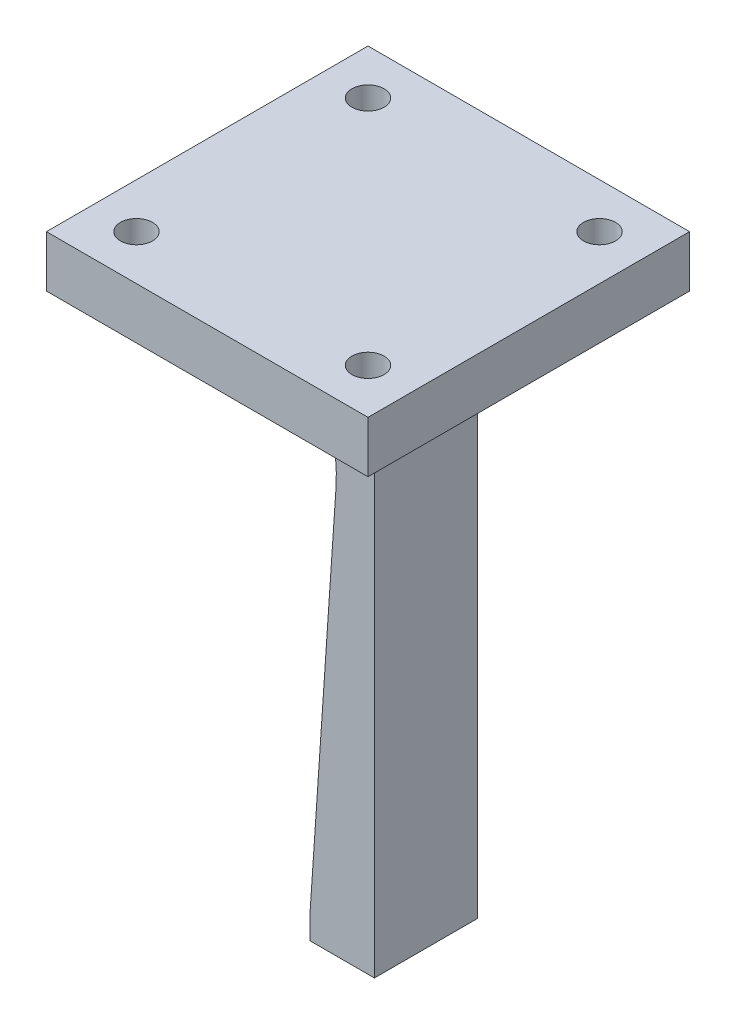
from build123d import *

# Parameters (mm, degrees)
SKETCH_1_W           = 25
SKETCH_1_H           = 25
SKETCH_1_W_2         = 13
SKETCH_1_H_2         = 13
EXTRUDE_1_DEPTH      = 4
EXTRUDE_5_DEPTH      = 4
EXTRUDE_5_DEPTH_BACK = 4
EXTRUDE_6_DEPTH      = 8
EXTRUDE_7_DEPTH      = 8
SKETCH_10_W          = 13
SKETCH_10_H          = 13.001688454
EXTRUDE_8_DEPTH      = 2
SKETCH_11_R          = 1.25
CUT_EXTRUDE_1_DEPTH  = 54.272882407


with BuildPart() as part:
    # Эскиз1 → Бобышка-Вытянуть1 (new body)
    with BuildSketch(Plane(origin=(0, 0, 0), x_dir=(1, 0, 0), z_dir=(0, 1, 0))):
        with Locations((6.5, 6.5)):
            Rectangle(SKETCH_1_W, SKETCH_1_H)
        with Locations((6.5, 6.5)):
            Rectangle(SKETCH_1_W_2, SKETCH_1_H_2, mode=Mode.SUBTRACT)
    extrude(amount=EXTRUDE_1_DEPTH)

    # Эскиз6 → Бобышка-Вытянуть5 (add, two sides: drawn at the far end of the back side and taken through both)
    with BuildSketch(Plane(origin=(0, 0, -6.5), x_dir=(-1, 0, 0), z_dir=(0, 0, -1)).offset(-EXTRUDE_5_DEPTH_BACK)):
        Polygon((-13, 4), (-9, 4), (-9, -40), (-6, -40), (-6, -42), (-11, -42), (-11, 2), (-13, 2), align=None)
    extrude(amount=EXTRUDE_5_DEPTH + EXTRUDE_5_DEPTH_BACK)

    # Эскиз7 → Бобышка-Вытянуть6 (add)
    with BuildSketch(Plane(origin=(0, 0, -10.5), x_dir=(-1, 0, 0), z_dir=(0, 0, -1))):
        Polygon((-9, -40), (-9, 4), (-6, -40), align=None)
    extrude(amount=-EXTRUDE_6_DEPTH)

    # Эскиз9 → Бобышка-Вытянуть7 (add)
    with BuildSketch(Plane.XY.offset(-2.5)):
        with BuildLine():
            Line((9, 4), (0, 4))
            Line((0, 4), (0, 2))
            ThreePointArc((0, 2), (6.069824399, -2.94312486), (8.009524283, -10.526977177))
            Line((8.009524283, -10.526977177), (9, 4))
        make_face()
    extrude(amount=-EXTRUDE_7_DEPTH)

    # Эскиз10 → Бобышка-Вытянуть8 (add)
    with BuildSketch(Plane(origin=(0, 4, 0), x_dir=(1, 0, 0), z_dir=(0, 1, 0))):
        with Locations((6.5, 6.499155773)):
            Rectangle(SKETCH_10_W, SKETCH_10_H)
    extrude(amount=-EXTRUDE_8_DEPTH)

    # Эскиз11 → Вырез-Вытянуть1 (cut, through all)
    with BuildSketch(Plane(origin=(0, 4, 0), x_dir=(1, 0, 0), z_dir=(0, 1, 0))):
        with Locations(Location((-2.5, 15.5, 0), (0, 0, 270))):
            Circle(SKETCH_11_R)
        with Locations(Location((15.5, 15.5, 0), (0, 0, 270))):
            Circle(SKETCH_11_R)
        with Locations(Location((-2.5, -2.5, 0), (0, 0, 270))):
            Circle(SKETCH_11_R)
        with Locations(Location((15.5, -2.5, 0), (0, 0, 270))):
            Circle(SKETCH_11_R)
    extrude(amount=-CUT_EXTRUDE_1_DEPTH, mode=Mode.SUBTRACT)


solid = part.part
